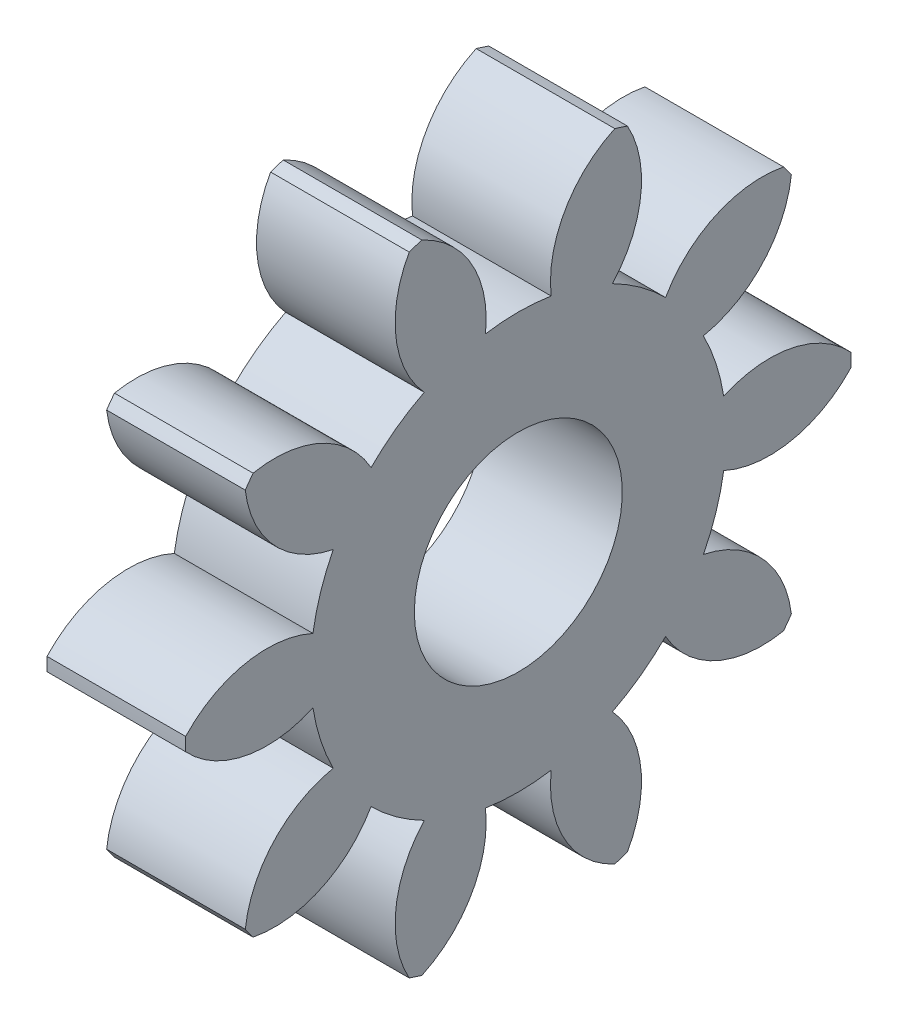
from build123d import *

# Parameters (mm, degrees)
BASPROSKE_W     = 2
BASPROSKE_H     = 4.8
TOOTHCUT_DEPTH  = 8.076722405
TEETHCUTS_COUNT = 10
TEETHCUTS_ANGLE = 324
BORSKE_R        = 1.5
BORE_DEPTH      = 50.0000508


with BuildPart() as part:
    # BasProSke → Base-Revolve (revolve)
    with BuildSketch(Plane(origin=(0, 0, 0), x_dir=(1, 0, 0), z_dir=(0, 1, 0)), mode=Mode.PRIVATE) as base_revolve_sk:
        with Locations((1, 2.4)):
            Rectangle(BASPROSKE_W, BASPROSKE_H)
    revolve(base_revolve_sk.sketch.rotate(Axis((-10, 0, 0), (1, 0, 0)), 180), axis=Axis((-10, 0, 0), (1, 0, 0)))

    # TooCutSke → ToothCut (cut, through all)
    with BuildSketch(Plane(origin=(0, 0, 0), x_dir=(0, 0, -1), z_dir=(1, 0, 0))):
        with BuildLine():
            ThreePointArc((0.473726058, 2.961348446), (0, 2.999), (-0.473726058, 2.961348446))
            ThreePointArc((-0.473726058, 2.961348446), (-0.678470427, 3.942691912), (-1.42693485, 4.6095924))
            ThreePointArc((-1.42693485, 4.6095924), (0, 4.8254), (1.42693485, 4.6095924))
            ThreePointArc((1.42693485, 4.6095924), (0.678470427, 3.942691912), (0.473726058, 2.961348446))
        make_face()
    toothcut = extrude(amount=TOOTHCUT_DEPTH, mode=Mode.SUBTRACT)

    # TeethCuts: ToothCut ×10 about axis
    teethcuts_axis = Axis((-10, 0, 0), (1, 0, 0))
    for i in range(1, TEETHCUTS_COUNT):
        add(toothcut.rotate(teethcuts_axis, i * TEETHCUTS_ANGLE / (TEETHCUTS_COUNT - 1)), mode=Mode.SUBTRACT)

    # BorSke → Bore (cut, symmetric)
    with BuildSketch(Plane(origin=(0, 0, 0), x_dir=(0, 0, -1), z_dir=(1, 0, 0))):
        with Locations(Location((0, 0, 0), (0, 0, 180))):
            Circle(BORSKE_R)
    extrude(amount=BORE_DEPTH, both=True, mode=Mode.SUBTRACT)


solid = part.part
